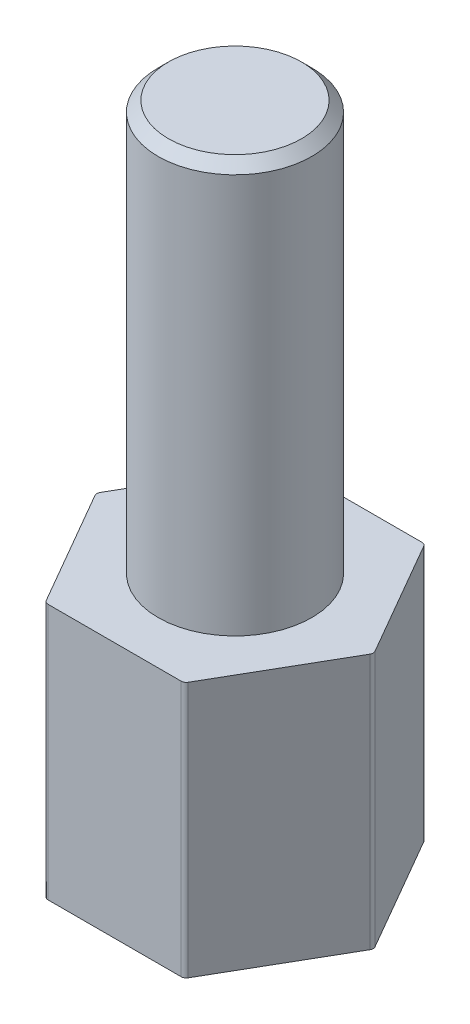
from build123d import *

# Parameters (mm, degrees)
EXTRUDE_1_DEPTH     = 5
SKETCH_2_R          = 1.5
EXTRUDE_2_DEPTH     = 8
SKETCH_3_R          = 1.5
CUT_EXTRUDE_1_DEPTH = 4
CHAMFER_1_SIZE      = 0.2
FILLET_1_R          = 0.1


with BuildPart() as part:
    # 草图1 → 凸台-拉伸1 (new body)
    with BuildSketch(Plane(origin=(0, 0, 0), x_dir=(1, 0, 0), z_dir=(0, 1, 0))):
        Polygon((2.713546265, 0), (1.356773133, 2.35), (-1.356773133, 2.35), (-2.713546265, 0), (-1.356773133, -2.35), (1.356773133, -2.35), align=None)
    extrude(amount=EXTRUDE_1_DEPTH)

    # 草图2 → 凸台-拉伸2 (add)
    with BuildSketch(Plane(origin=(0, 5, 0), x_dir=(1, 0, 0), z_dir=(0, 1, 0))):
        with Locations(Location((0, 0, 0), (0, 0, 270))):
            Circle(SKETCH_2_R)
    extrude(amount=EXTRUDE_2_DEPTH)

    # 草图3 → 切除-拉伸1 (cut)
    with BuildSketch(Plane.XZ):
        with Locations(Location((0, 0, 0), (0, 0, 90))):
            Circle(SKETCH_3_R)
    extrude(amount=-CUT_EXTRUDE_1_DEPTH, mode=Mode.SUBTRACT)

    # 倒角1
    chamfer_1_edges = [part.edges().sort_by_distance(p)[0] for p in [
        (0, 13, -1.5),
        (0, 4, -1.5),
    ]]
    chamfer(chamfer_1_edges, length=CHAMFER_1_SIZE)

    # 圆角1
    fillet_1_edges = [part.edges().sort_by_distance(p)[0] for p in [
        (1.356773133, 2.5, 2.35),
        (-1.356773133, 2.5, 2.35),
        (-2.713546265, 2.5, 0),
        (-1.356773133, 2.5, -2.35),
        (1.356773133, 2.5, -2.35),
        (2.713546265, 2.5, 0),
    ]]
    fillet(fillet_1_edges, radius=FILLET_1_R)


solid = part.part
